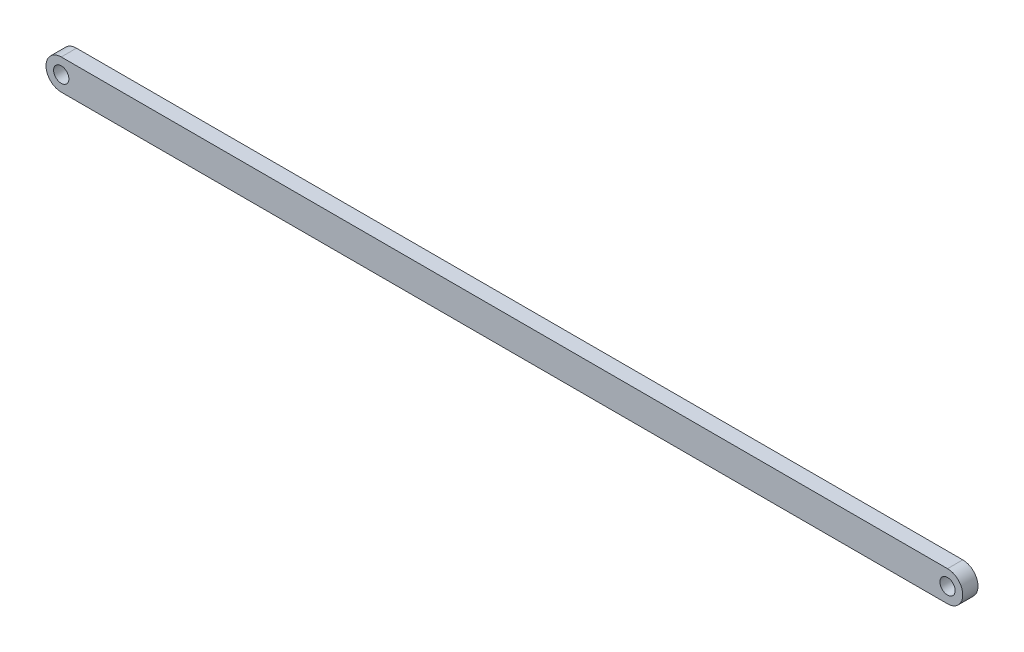
from build123d import *

# Parameters (mm, degrees)
ESBO_O1_R                = 2.5
RESSALTO_EXTRUS_O1_DEPTH = 5


with BuildPart() as part:
    # Esboço1 → Ressalto-extrusão1 (new body)
    with BuildSketch(Plane.XY):
        with BuildLine():
            Line((-145.38, 5), (145.38, 5))
            ThreePointArc((145.38, 5), (150.38, 0), (145.38, -5))
            Line((145.38, -5), (-145.38, -5))
            ThreePointArc((-145.38, -5), (-150.38, 0), (-145.38, 5))
        make_face()
        with Locations((-145.38, 0)):
            Circle(ESBO_O1_R, mode=Mode.SUBTRACT)
        with Locations((145.38, 0)):
            Circle(ESBO_O1_R, mode=Mode.SUBTRACT)
    extrude(amount=RESSALTO_EXTRUS_O1_DEPTH)


solid = part.part
